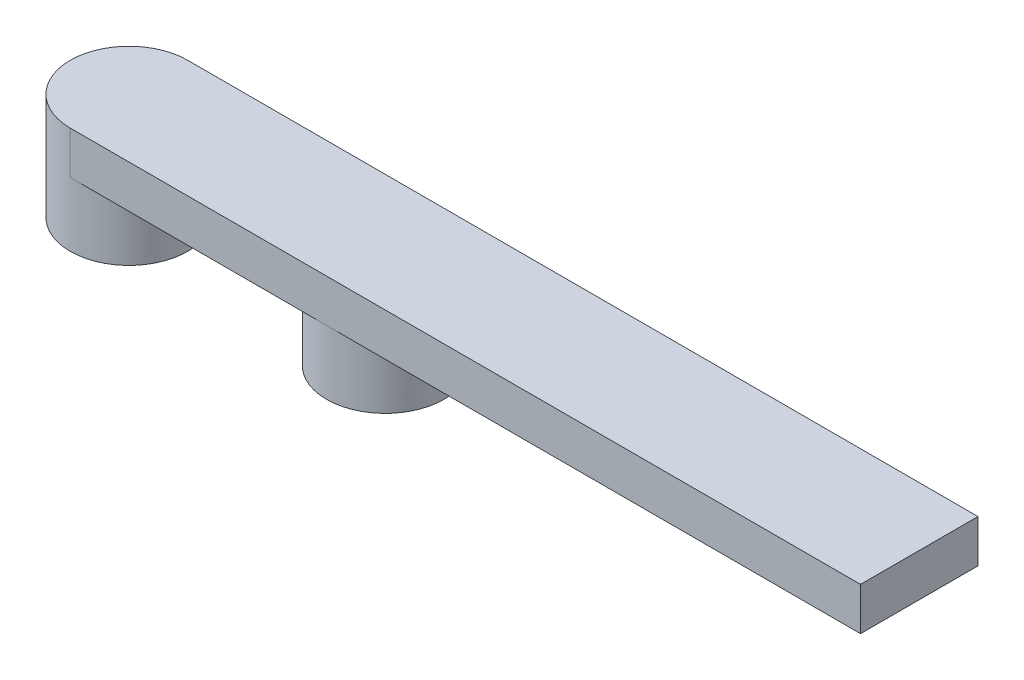
from build123d import *

# Parameters (mm, degrees)
BOSS_EXTRUDE1_DEPTH = 2
BOSS_EXTRUDE2_START = -3
SKETCH1_3_R         = 2.75
BOSS_EXTRUDE2_DEPTH = 3


with BuildPart() as part:
    # Sketch1 → Boss-Extrude1 (new body)
    with BuildSketch(Plane(origin=(0, 0, 0), x_dir=(1, 0, 0), z_dir=(0, 1, 0))):
        with BuildLine():
            Line((37, 2.75), (0, 2.75))
            ThreePointArc((0, 2.75), (-2.75, 0), (0, -2.75))
            Line((0, -2.75), (37, -2.75))
            Line((37, -2.75), (37, 2.75))
        make_face()
    extrude(amount=BOSS_EXTRUDE1_DEPTH)

    # Sketch1<3> → Boss-Extrude2 (add)
    with BuildSketch(Plane(origin=(0, 0, 0), x_dir=(1, 0, 0), z_dir=(0, 1, 0)).offset(BOSS_EXTRUDE2_START)):
        with Locations((12, 0)):
            Circle(SKETCH1_3_R)
        Circle(SKETCH1_3_R)
    extrude(amount=BOSS_EXTRUDE2_DEPTH)


solid = part.part
